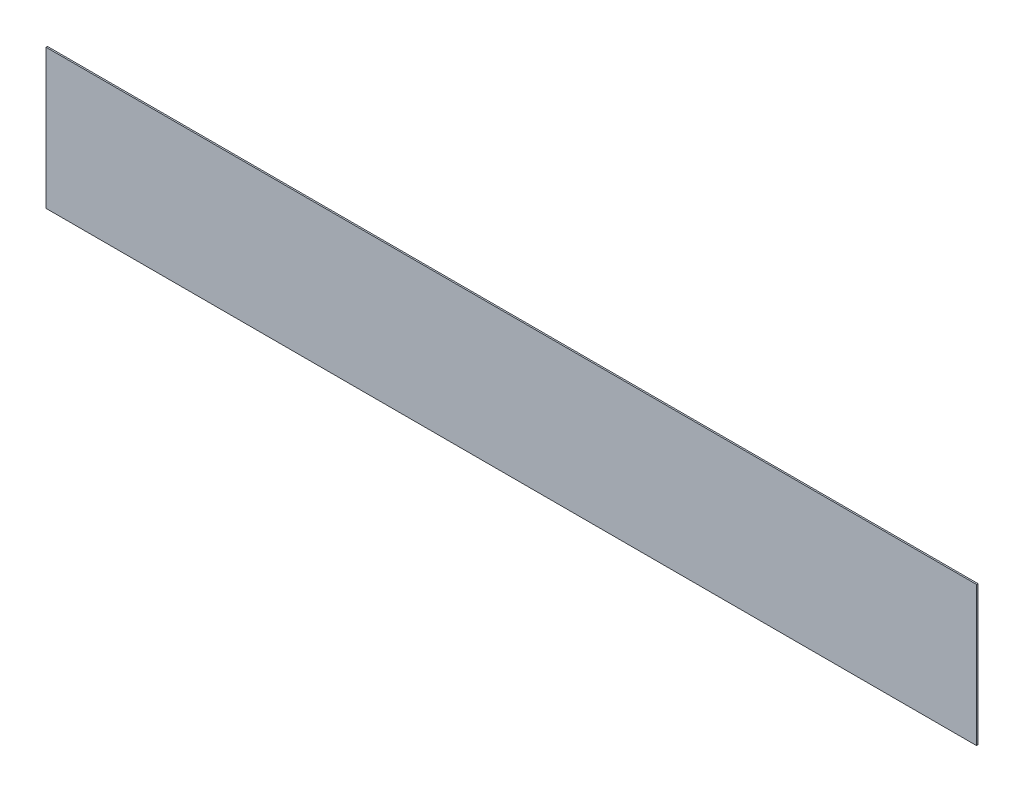
from build123d import *

# Parameters (mm, degrees)
SKETCH1_W           = 1016
SKETCH1_H           = 152.4
BOSS_EXTRUDE1_DEPTH = 1.5875


with BuildPart() as part:
    # Sketch1 → Boss-Extrude1 (new body)
    with BuildSketch(Plane.XY):
        Rectangle(SKETCH1_W, SKETCH1_H)
    extrude(amount=BOSS_EXTRUDE1_DEPTH)


solid = part.part
